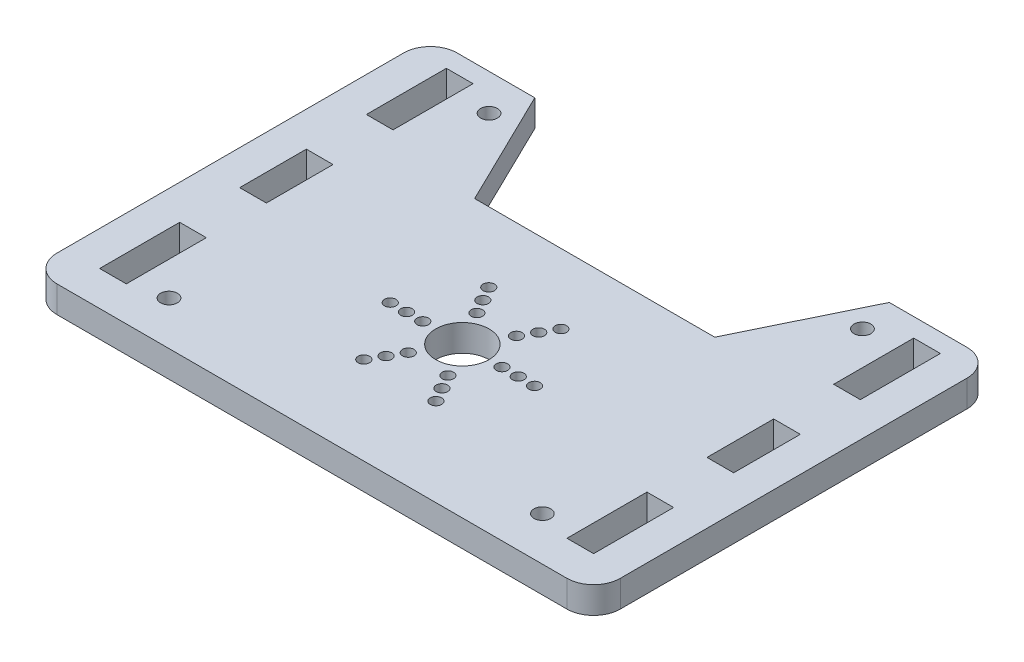
from build123d import *

# Parameters (mm, degrees)
SKETCH_1_R      = 5
SKETCH_1_R_2    = 1.075
SKETCH_1_R_3    = 1.575
SKETCH_1_W      = 5
SKETCH_1_H      = 15
SKETCH_1_H_2    = 12.5
EXTRUDE_1_DEPTH = 5
FILLET_1_R      = 5


with BuildPart() as part:
    # 草图1 → 凸台-拉伸1 (new body)
    with BuildSketch(Plane(origin=(0, 0, 0), x_dir=(1, 0, 0), z_dir=(0, 1, 0))):
        Polygon((52.8, -28.197121602), (-52.8, -28.197121602), (-52.8, 46.802878398), (-33.230116948, 46.802878398), (-22.5, 24.802878398), (22.5, 24.802878398), (33.230116948, 46.802878398), (52.8, 46.802878398), align=None)
        with Locations(Location((0, 0, 0), (0, 0, 270))):
            Circle(SKETCH_1_R, mode=Mode.SUBTRACT)
        with Locations(Location((-13.525, 0, 0), (0, 0, 270))):
            Circle(SKETCH_1_R_2, mode=Mode.SUBTRACT)
        with Locations(Location((-10.475, 0, 0), (0, 0, 270))):
            Circle(SKETCH_1_R_2, mode=Mode.SUBTRACT)
        with Locations(Location((-7.425, 0, 0), (0, 0, 270))):
            Circle(SKETCH_1_R_2, mode=Mode.SUBTRACT)
        with Locations(Location((-6.7625, 11.712993586, 0), (0, 0, 270))):
            Circle(SKETCH_1_R_2, mode=Mode.SUBTRACT)
        with Locations(Location((-5.2375, 9.071616105, 0), (0, 0, 270))):
            Circle(SKETCH_1_R_2, mode=Mode.SUBTRACT)
        with Locations(Location((-3.7125, 6.430238623, 0), (0, 0, 270))):
            Circle(SKETCH_1_R_2, mode=Mode.SUBTRACT)
        with Locations(Location((6.7625, 11.712993586, 0), (0, 0, 270))):
            Circle(SKETCH_1_R_2, mode=Mode.SUBTRACT)
        with Locations(Location((5.2375, 9.071616105, 0), (0, 0, 270))):
            Circle(SKETCH_1_R_2, mode=Mode.SUBTRACT)
        with Locations(Location((3.7125, 6.430238623, 0), (0, 0, 270))):
            Circle(SKETCH_1_R_2, mode=Mode.SUBTRACT)
        with Locations(Location((13.525, 0, 0), (0, 0, 270))):
            Circle(SKETCH_1_R_2, mode=Mode.SUBTRACT)
        with Locations(Location((10.475, 0, 0), (0, 0, 270))):
            Circle(SKETCH_1_R_2, mode=Mode.SUBTRACT)
        with Locations(Location((7.425, 0, 0), (0, 0, 270))):
            Circle(SKETCH_1_R_2, mode=Mode.SUBTRACT)
        with Locations(Location((6.7625, -11.712993586, 0), (0, 0, 270))):
            Circle(SKETCH_1_R_2, mode=Mode.SUBTRACT)
        with Locations(Location((5.2375, -9.071616105, 0), (0, 0, 270))):
            Circle(SKETCH_1_R_2, mode=Mode.SUBTRACT)
        with Locations(Location((3.7125, -6.430238623, 0), (0, 0, 270))):
            Circle(SKETCH_1_R_2, mode=Mode.SUBTRACT)
        with Locations(Location((-6.7625, -11.712993586, 0), (0, 0, 270))):
            Circle(SKETCH_1_R_2, mode=Mode.SUBTRACT)
        with Locations(Location((-5.2375, -9.071616105, 0), (0, 0, 270))):
            Circle(SKETCH_1_R_2, mode=Mode.SUBTRACT)
        with Locations(Location((-3.7125, -6.430238623, 0), (0, 0, 270))):
            Circle(SKETCH_1_R_2, mode=Mode.SUBTRACT)
        with Locations(Location((-35, -20, 0), (0, 0, 270))):
            Circle(SKETCH_1_R_3, mode=Mode.SUBTRACT)
        with Locations(Location((-35, 40, 0), (0, 0, 270))):
            Circle(SKETCH_1_R_3, mode=Mode.SUBTRACT)
        with Locations(Location((35, 40, 0), (0, 0, 90))):
            Circle(SKETCH_1_R_3, mode=Mode.SUBTRACT)
        with Locations(Location((35, -20, 0), (0, 0, 90))):
            Circle(SKETCH_1_R_3, mode=Mode.SUBTRACT)
        with Locations((-43.8, 35.802878398)):
            Rectangle(SKETCH_1_W, SKETCH_1_H, mode=Mode.SUBTRACT)
        with Locations((-43.8, 10.802878398)):
            Rectangle(SKETCH_1_W, SKETCH_1_H_2, mode=Mode.SUBTRACT)
        with Locations((-43.8, -14.197121602)):
            Rectangle(SKETCH_1_W, SKETCH_1_H, mode=Mode.SUBTRACT)
        with Locations((43.8, -14.197121602)):
            Rectangle(SKETCH_1_W, SKETCH_1_H, mode=Mode.SUBTRACT)
        with Locations((43.8, 10.802878398)):
            Rectangle(SKETCH_1_W, SKETCH_1_H_2, mode=Mode.SUBTRACT)
        with Locations((43.8, 35.802878398)):
            Rectangle(SKETCH_1_W, SKETCH_1_H, mode=Mode.SUBTRACT)
    extrude(amount=EXTRUDE_1_DEPTH)

    # 圆角1
    fillet_1_edges = [part.edges().sort_by_distance(p)[0] for p in [
        (52.8, 2.5, -46.802878398),
        (52.8, 2.5, 28.197121602),
        (-52.8, 2.5, 28.197121602),
        (-52.8, 2.5, -46.802878398),
    ]]
    fillet(fillet_1_edges, radius=FILLET_1_R)


solid = part.part
